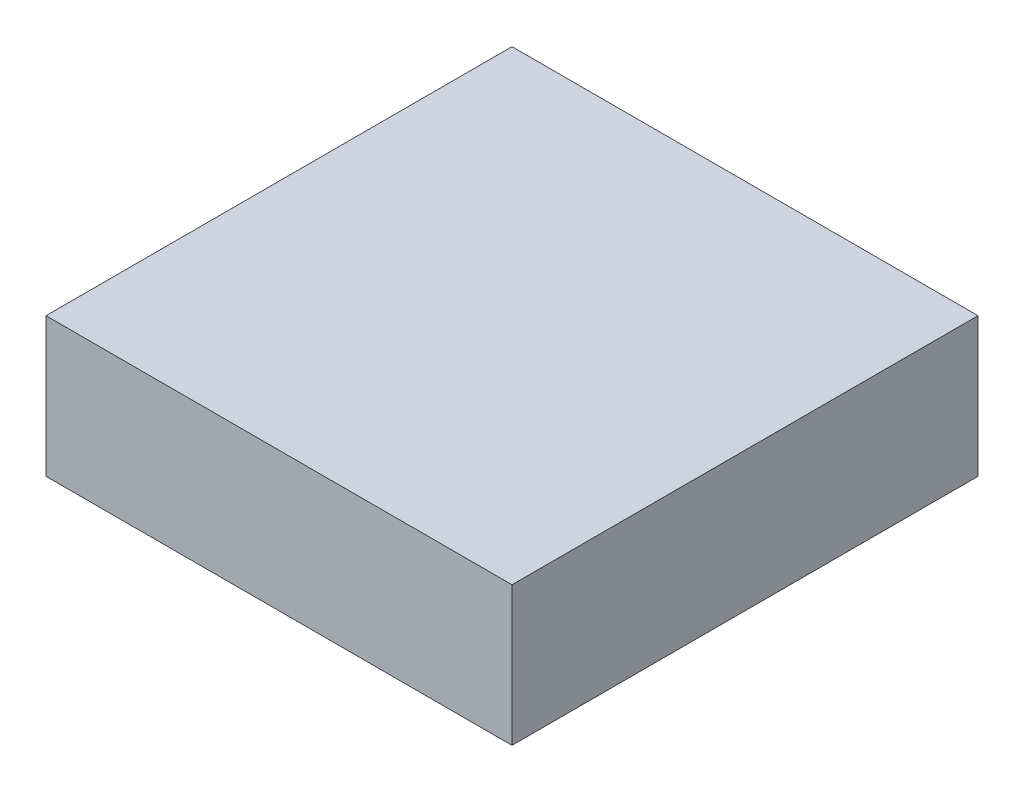
from build123d import *

# Parameters (mm, degrees)
SKETCH5_W           = 170.18
SKETCH5_H           = 170.18
BOSS_EXTRUDE5_DEPTH = 50.8


with BuildPart() as part:
    # Sketch5 → Boss-Extrude5 (new body)
    with BuildSketch(Plane(origin=(0, 0, 0), x_dir=(1, 0, 0), z_dir=(0, 1, 0))):
        with Locations((85.09, 85.09)):
            Rectangle(SKETCH5_W, SKETCH5_H)
    extrude(amount=BOSS_EXTRUDE5_DEPTH)


solid = part.part
